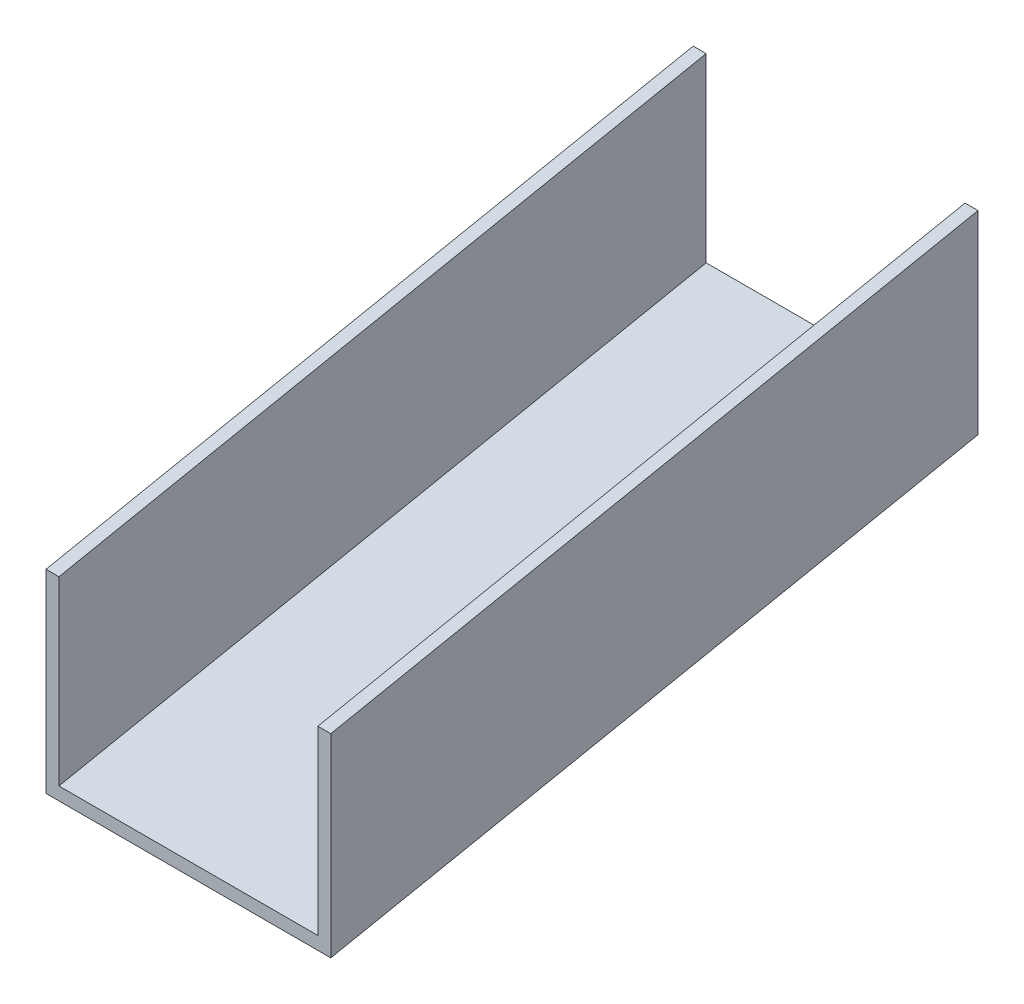
from build123d import *


with BuildPart() as part:
    # Sketch2 → Loft3 section 0
    with BuildSketch(Plane.XY.offset(100)):
        with BuildLine():
            Line((44, 10), (44, -20))
            Line((44, -20), (0, -20))
            Line((0, -20), (0, 10))
            Line((0, 10), (2, 10))
            Line((2, 10), (2, -18))
            Line((2, -18), (42, -18))
            Line((42, -18), (42, 10))
            Line((42, 10), (44, 10))
        make_face()
    # Sketch1 → Loft3 section 1
    with BuildSketch(Plane.XY):
        with BuildLine():
            Line((44, 30), (44, 0))
            Line((44, 0), (0, 0))
            Line((0, 0), (0, 30))
            Line((0, 30), (2, 30))
            Line((2, 30), (2, 2))
            Line((2, 2), (42, 2))
            Line((42, 2), (42, 30))
            Line((42, 30), (44, 30))
        make_face()
    loft()


solid = part.part
